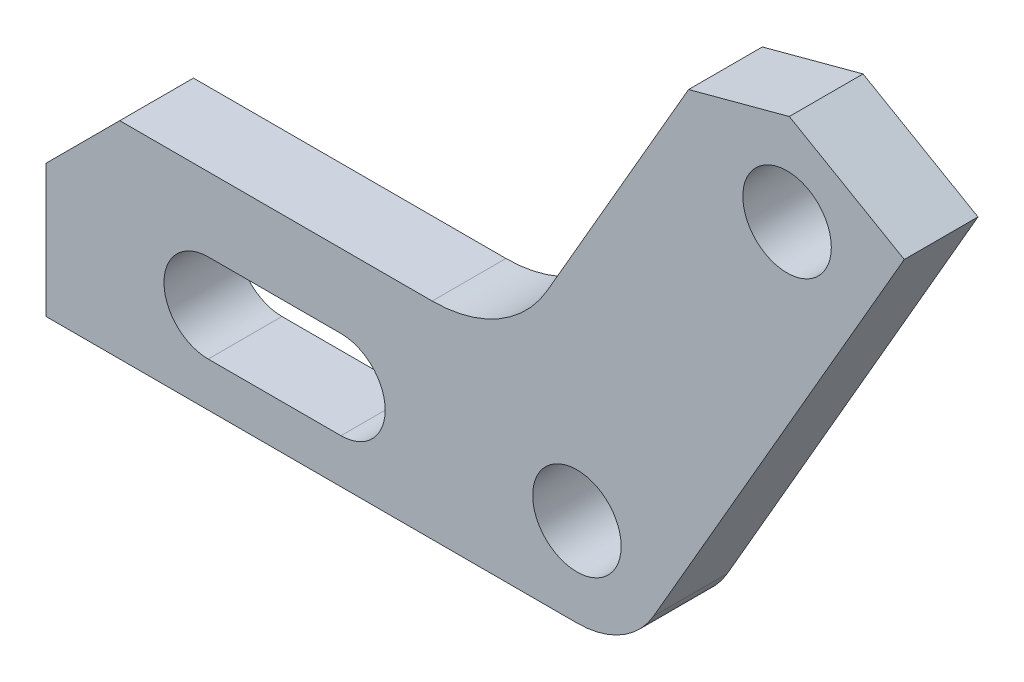
from build123d import *

# Parameters (mm, degrees)
CROQUIS1_R              = 6
SALIENTE_EXTRUIR1_DEPTH = 10


with BuildPart() as part:
    # Croquis1 → Saliente-Extruir1 (new body)
    with BuildSketch(Plane.XY):
        with BuildLine():
            Line((-62, 16), (-19.629909152, 16))
            ThreePointArc((-19.629909152, 16), (-10.629909152, 18.411542732), (-4.041451884, 25))
            Line((-4.041451884, 25), (15.143593539, 58.229473419))
            Line((15.143593539, 58.229473419), (28.803847577, 61.889727457))
            Line((28.803847577, 61.889727457), (44.392304845, 52.889727457))
            Line((44.392304845, 52.889727457), (10.392304845, -6))
            ThreePointArc((10.392304845, -6), (6, -10.392304845), (0, -12))
            Line((0, -12), (-72, -12))
            Line((-72, -12), (-72, 6))
            Line((-72, 6), (-62, 16))
        make_face()
        Circle(CROQUIS1_R, mode=Mode.SUBTRACT)
        with Locations((28.5, 49.363448016)):
            Circle(CROQUIS1_R, mode=Mode.SUBTRACT)
        with BuildLine():
            Line((-32, -6), (-50, -6))
            ThreePointArc((-50, -6), (-56, 0), (-50, 6))
            Line((-50, 6), (-32, 6))
            ThreePointArc((-32, 6), (-26, 0), (-32, -6))
        make_face(mode=Mode.SUBTRACT)
    extrude(amount=SALIENTE_EXTRUIR1_DEPTH)


solid = part.part
